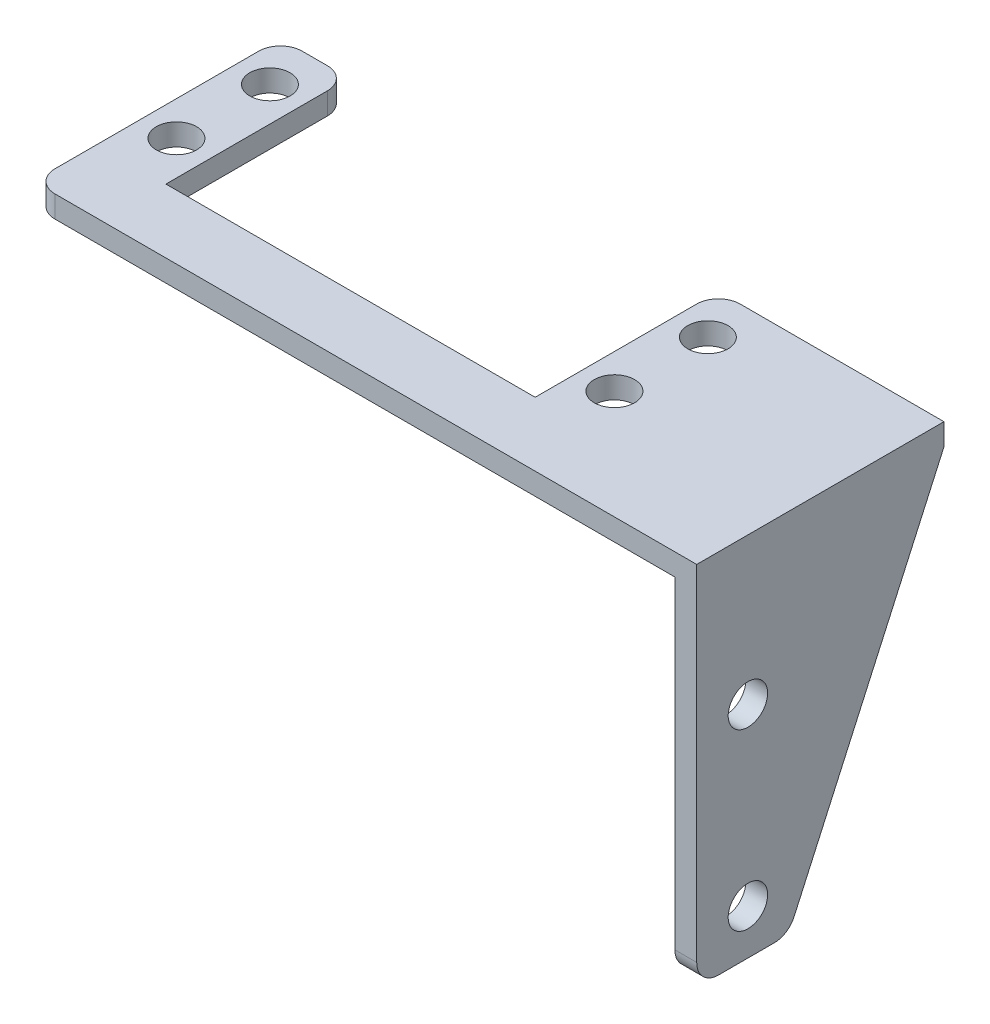
from build123d import *

# Parameters (mm, degrees)
SKETCH1_R           = 2.2
BOSS_EXTRUDE1_DEPTH = 2.38125
BOSS_EXTRUDE3_DEPTH = 2.38125
SKETCH4_R           = 2.15265
CUT_EXTRUDE1_DEPTH  = 2.38125
FILLET2_R           = 2.38125


with BuildPart() as part:
    # Sketch1 → Boss-Extrude1 (new body)
    # profile 1 of 2: a face of its own
    with BuildSketch(Plane(origin=(0, 0, 0), x_dir=(1, 0, 0), z_dir=(0, 1, 0))):
        Polygon((0, -6.985), (0, 0), (-20.15, 0), (-20.15, 20), (-27.65, 20), (-27.65, -6.985), align=None)
        with Locations(Location((-23.9, 4.9, 0), (0, 0, 90))):
            Circle(SKETCH1_R, mode=Mode.SUBTRACT)
        with Locations(Location((-23.9, 15.1, 0), (0, 0, 90))):
            Circle(SKETCH1_R, mode=Mode.SUBTRACT)
    # profile 2 of 2: a face of its own
    with BuildSketch(Plane(origin=(0, 0, 0), x_dir=(1, 0, 0), z_dir=(0, 1, 0))):
        Polygon((20.15, 20), (20.15, 0), (0, 0), (0, -6.985), (27.65, -6.985), (42.38375, -6.985), (42.38375, 20), align=None)
        with Locations(Location((23.9, 4.9, 0), (0, 0, 90))):
            Circle(SKETCH1_R, mode=Mode.SUBTRACT)
        with Locations(Location((23.9, 15.1, 0), (0, 0, 90))):
            Circle(SKETCH1_R, mode=Mode.SUBTRACT)
    extrude(amount=BOSS_EXTRUDE1_DEPTH)

    # Sketch3 → Boss-Extrude3 (add)
    with BuildSketch(Plane(origin=(42.38375, 0, 0), x_dir=(0, 0, -1), z_dir=(1, 0, 0))):
        Polygon((20, 0), (3.015, -37.61875), (-6.985, -37.61875), (-6.985, 2.38125), (20, 2.38125), align=None)
    extrude(amount=BOSS_EXTRUDE3_DEPTH)

    # Sketch4 → Cut-Extrude1 (cut)
    with BuildSketch(Plane(origin=(44.765, 0, 0), x_dir=(0, 0, -1), z_dir=(1, 0, 0))):
        with Locations((-1.397, -13.64595)):
            Circle(SKETCH4_R)
        with Locations((-1.397, -32.69595)):
            Circle(SKETCH4_R)
    extrude(amount=-CUT_EXTRUDE1_DEPTH, mode=Mode.SUBTRACT)

    # Fillet2
    fillet2_edges = [part.edges().sort_by_distance(p)[0] for p in [
        (-27.65, 1.190625, 6.985),
        (-27.65, 1.190625, -20),
        (-20.15, 1.190625, -20),
        (20.15, 1.190625, -20),
        (43.574375, -37.61875, 6.985),
        (43.574375, -37.61875, -3.015),
    ]]
    fillet(fillet2_edges, radius=FILLET2_R)


solid = part.part
